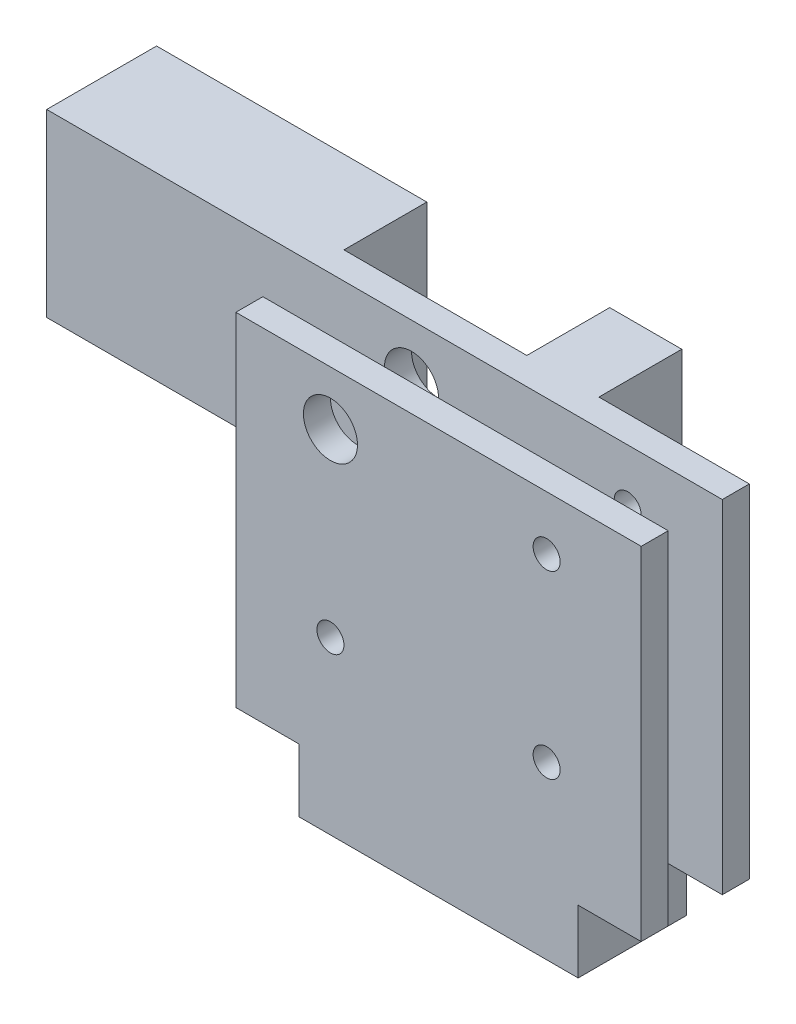
from build123d import *

# Parameters (mm, degrees)
SKETCH_1_W          = 45
SKETCH_1_H          = 45
EXTRUDE_1_DEPTH     = 12
SKETCH_2_W          = 6
SKETCH_2_H          = 38
CUT_EXTRUDE_1_DEPTH = 52.722818949
SKETCH_3_R          = 3
SKETCH_3_R_2        = 1.5
CUT_EXTRUDE_2_DEPTH = 35.007352146
SKETCH_4_R          = 1.5
CUT_EXTRUDE_3_DEPTH = 35.007352146
SKETCH_6_W          = 7
SKETCH_6_H          = 12
CUT_EXTRUDE_4_DEPTH = 7
SKETCH_7_W          = 30
SKETCH_7_H          = 20
SKETCH_7_W_2        = 8
EXTRUDE_2_DEPTH     = 9.2
SKETCH_9_W          = 30
SKETCH_9_H          = 20
EXTRUDE_4_DEPTH     = 3


with BuildPart() as part:
    # 草图1 → 凸台-拉伸1 (new body)
    with BuildSketch(Plane.XY):
        Rectangle(SKETCH_1_W, SKETCH_1_H)
    extrude(amount=EXTRUDE_1_DEPTH)

    # 草图2 → 切除-拉伸1 (cut, through all)
    with BuildSketch(Plane.ZY.offset(22.5)):
        with Locations((6, 3.5)):
            Rectangle(SKETCH_2_W, SKETCH_2_H)
    extrude(amount=-CUT_EXTRUDE_1_DEPTH, mode=Mode.SUBTRACT)

    # 草图3 → 切除-拉伸2 (cut, through all)
    with BuildSketch(Plane.XY.offset(12)):
        with Locations((-12, 16.5)):
            Circle(SKETCH_3_R)
        with Locations((12, 16.5)):
            Circle(SKETCH_3_R_2)
    extrude(amount=-CUT_EXTRUDE_2_DEPTH, mode=Mode.SUBTRACT)

    # 草图4 → 切除-拉伸3 (cut, through all)
    with BuildSketch(Plane.XY.offset(12)):
        with Locations((-12, -3.5)):
            Circle(SKETCH_4_R)
        with Locations((12, -3.5)):
            Circle(SKETCH_4_R)
    extrude(amount=-CUT_EXTRUDE_3_DEPTH, mode=Mode.SUBTRACT)

    # 草图6 → 切除-拉伸4 (cut)
    with BuildSketch(Plane.XZ.offset(22.5)):
        with Locations((-19, 6)):
            Rectangle(SKETCH_6_W, SKETCH_6_H)
        with Locations((19, 6)):
            Rectangle(SKETCH_6_W, SKETCH_6_H)
    extrude(amount=-CUT_EXTRUDE_4_DEPTH, mode=Mode.SUBTRACT)

    # 草图7 → 凸台-拉伸2 (add)
    with BuildSketch(Plane(origin=(0, 0, 0), x_dir=(-1, 0, 0), z_dir=(0, 0, -1))):
        with Locations((37.5, 12.5)):
            Rectangle(SKETCH_7_W, SKETCH_7_H)
        with Locations((-1.8, 12.5)):
            Rectangle(SKETCH_7_W_2, SKETCH_7_H)
    extrude(amount=EXTRUDE_2_DEPTH)


with BuildPart() as extrude_2_piece_1:
    # of the separate pieces the step leaves, piece 1, a body of its own (extrude_2_pieces)
    add(part.part.solids().sort_by_distance((15.5, -22.5, 0))[0])



with BuildPart() as extrude_2_piece_2:
    # of the separate pieces the step leaves, piece 2, a body of its own (extrude_2_pieces)
    add(part.part.solids().sort_by_distance((-22.5, 2.5, -9.2))[0])


with BuildPart() as extrude_2_piece_1_1:
    add(extrude_2_piece_1.part)

    add(extrude_2_piece_2.part)  # 凸台-拉伸4 merges 凸台-拉伸2 piece 2
    # 草图9 → 凸台-拉伸4 (add)
    with BuildSketch(Plane.XY):
        with Locations((-37.5, 12.5)):
            Rectangle(SKETCH_9_W, SKETCH_9_H)
    extrude(amount=EXTRUDE_4_DEPTH)


solid = extrude_2_piece_1_1.part
